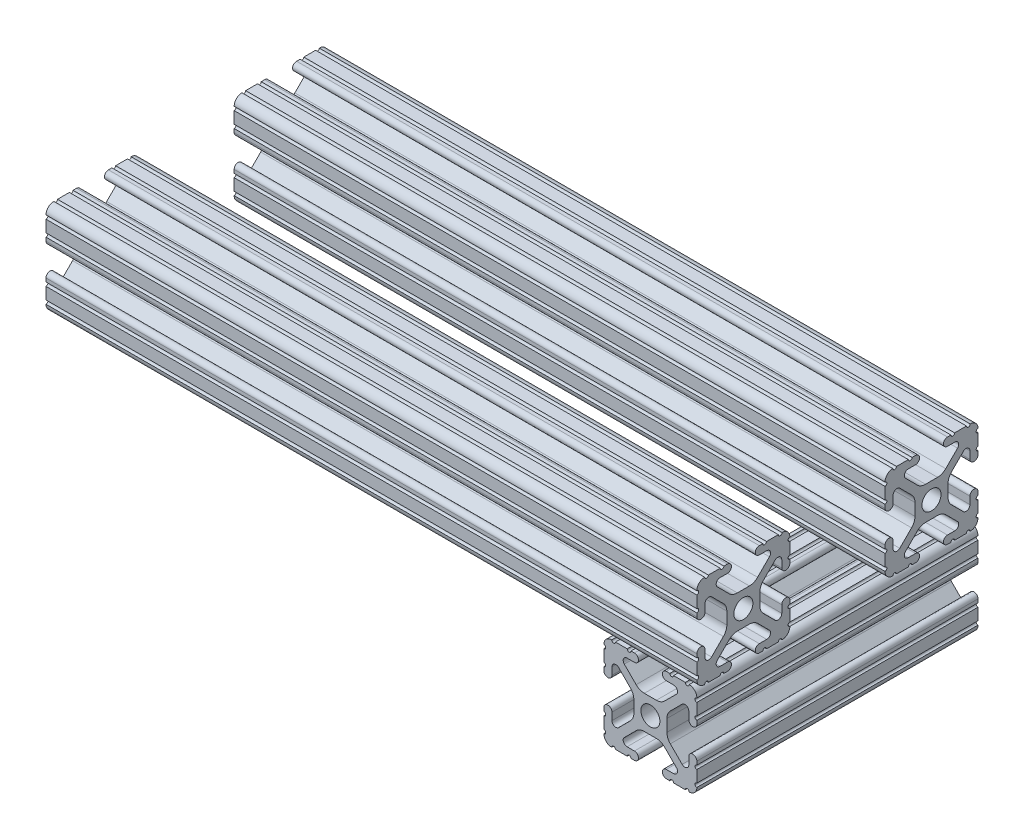
from build123d import *

# Parameters (mm, degrees)
SKETCH1_R                  = 2.6035
MEMBER_8020_1010_1_DEPTH   = 177.8
SKETCH1_ON_SEGMENT_2_R     = 2.6035
MEMBER_8020_1010_1_2_DEPTH = 177.8
SKETCH13_R                 = 2.6035
MEMBER_8020_1010_2_DEPTH   = 76.8
BODY_MOVE_COPY2_ANGLE      = 90


with BuildPart() as part:
    # Sketch1 → Member 8020 1010_1 (new body)
    with BuildSketch(Plane.XY):
        with BuildLine():
            Line((10.5918, 12.7), (10.5664, 12.7))
            ThreePointArc((10.5664, 12.7), (10.0584, 12.192), (9.5504, 12.7))
            Line((9.5504, 12.7), (6.3246, 12.7))
            ThreePointArc((6.3246, 12.7), (5.8166, 12.192), (5.3086, 12.7))
            Line((5.3086, 12.7), (4.3561, 12.7))
            ThreePointArc((4.3561, 12.7), (3.2512, 11.5951), (4.3561, 10.4902))
            Line((4.3561, 10.4902), (6.370083786, 10.4902))
            ThreePointArc((6.370083786, 10.4902), (7.348856743, 9.836204819), (7.119204175, 8.681663397))
            Line((7.119204175, 8.681663397), (3.88464389, 5.447103113))
            ThreePointArc((3.88464389, 5.447103113), (2.854599758, 4.758849627), (1.63957986, 4.517167143))
            Line((1.63957986, 4.517167143), (-1.63957986, 4.517167143))
            ThreePointArc((-1.63957986, 4.517167143), (-2.854599758, 4.758849627), (-3.88464389, 5.447103113))
            Line((-3.88464389, 5.447103113), (-7.119204175, 8.681663397))
            ThreePointArc((-7.119204175, 8.681663397), (-7.348856743, 9.836204819), (-6.370083786, 10.4902))
            Line((-6.370083786, 10.4902), (-4.3561, 10.4902))
            ThreePointArc((-4.3561, 10.4902), (-3.2512, 11.5951), (-4.3561, 12.7))
            Line((-4.3561, 12.7), (-5.3086, 12.7))
            ThreePointArc((-5.3086, 12.7), (-5.8166, 12.192), (-6.3246, 12.7))
            Line((-6.3246, 12.7), (-9.5504, 12.7))
            ThreePointArc((-9.5504, 12.7), (-10.0584, 12.192), (-10.5664, 12.7))
            Line((-10.5664, 12.7), (-10.5918, 12.7))
            ThreePointArc((-10.5918, 12.7), (-12.082522516, 12.082522516), (-12.7, 10.5918))
            Line((-12.7, 10.5918), (-12.7, 10.5664))
            ThreePointArc((-12.7, 10.5664), (-12.192, 10.0584), (-12.7, 9.5504))
            Line((-12.7, 9.5504), (-12.7, 6.3246))
            ThreePointArc((-12.7, 6.3246), (-12.192, 5.8166), (-12.7, 5.3086))
            Line((-12.7, 5.3086), (-12.7, 4.3561))
            ThreePointArc((-12.7, 4.3561), (-11.5951, 3.2512), (-10.4902, 4.3561))
            Line((-10.4902, 4.3561), (-10.4902, 6.370083786))
            ThreePointArc((-10.4902, 6.370083786), (-9.836204819, 7.348856743), (-8.681663397, 7.119204175))
            Line((-8.681663397, 7.119204175), (-5.447103113, 3.88464389))
            ThreePointArc((-5.447103113, 3.88464389), (-4.758849627, 2.854599758), (-4.517167143, 1.63957986))
            Line((-4.517167143, 1.63957986), (-4.517167143, -1.63957986))
            ThreePointArc((-4.517167143, -1.63957986), (-4.758849627, -2.854599758), (-5.447103113, -3.88464389))
            Line((-5.447103113, -3.88464389), (-8.681663397, -7.119204175))
            ThreePointArc((-8.681663397, -7.119204175), (-9.836204819, -7.348856743), (-10.4902, -6.370083786))
            Line((-10.4902, -6.370083786), (-10.4902, -4.3561))
            ThreePointArc((-10.4902, -4.3561), (-11.5951, -3.2512), (-12.7, -4.3561))
            Line((-12.7, -4.3561), (-12.7, -5.3086))
            ThreePointArc((-12.7, -5.3086), (-12.192, -5.8166), (-12.7, -6.3246))
            Line((-12.7, -6.3246), (-12.7, -9.5504))
            ThreePointArc((-12.7, -9.5504), (-12.192, -10.0584), (-12.7, -10.5664))
            Line((-12.7, -10.5664), (-12.7, -10.5918))
            ThreePointArc((-12.7, -10.5918), (-12.082522516, -12.082522516), (-10.5918, -12.7))
            Line((-10.5918, -12.7), (-10.5664, -12.7))
            ThreePointArc((-10.5664, -12.7), (-10.0584, -12.192), (-9.5504, -12.7))
            Line((-9.5504, -12.7), (-6.3246, -12.7))
            ThreePointArc((-6.3246, -12.7), (-5.8166, -12.192), (-5.3086, -12.7))
            Line((-5.3086, -12.7), (-4.3561, -12.7))
            ThreePointArc((-4.3561, -12.7), (-3.2512, -11.5951), (-4.3561, -10.4902))
            Line((-4.3561, -10.4902), (-6.370083786, -10.4902))
            ThreePointArc((-6.370083786, -10.4902), (-7.348856743, -9.836204819), (-7.119204175, -8.681663397))
            Line((-7.119204175, -8.681663397), (-3.88464389, -5.447103113))
            ThreePointArc((-3.88464389, -5.447103113), (-2.854599758, -4.758849627), (-1.63957986, -4.517167143))
            Line((-1.63957986, -4.517167143), (1.63957986, -4.517167143))
            ThreePointArc((1.63957986, -4.517167143), (2.854599758, -4.758849627), (3.88464389, -5.447103113))
            Line((3.88464389, -5.447103113), (7.119204175, -8.681663397))
            ThreePointArc((7.119204175, -8.681663397), (7.348856743, -9.836204819), (6.370083786, -10.4902))
            Line((6.370083786, -10.4902), (4.3561, -10.4902))
            ThreePointArc((4.3561, -10.4902), (3.2512, -11.5951), (4.3561, -12.7))
            Line((4.3561, -12.7), (5.3086, -12.7))
            ThreePointArc((5.3086, -12.7), (5.8166, -12.192), (6.3246, -12.7))
            Line((6.3246, -12.7), (9.5504, -12.7))
            ThreePointArc((9.5504, -12.7), (10.0584, -12.192), (10.5664, -12.7))
            Line((10.5664, -12.7), (10.5918, -12.7))
            ThreePointArc((10.5918, -12.7), (12.082522516, -12.082522516), (12.7, -10.5918))
            Line((12.7, -10.5918), (12.7, -10.5664))
            ThreePointArc((12.7, -10.5664), (12.192, -10.0584), (12.7, -9.5504))
            Line((12.7, -9.5504), (12.7, -6.3246))
            ThreePointArc((12.7, -6.3246), (12.192, -5.8166), (12.7, -5.3086))
            Line((12.7, -5.3086), (12.7, -4.3561))
            ThreePointArc((12.7, -4.3561), (11.5951, -3.2512), (10.4902, -4.3561))
            Line((10.4902, -4.3561), (10.4902, -6.370083786))
            ThreePointArc((10.4902, -6.370083786), (9.836204819, -7.348856743), (8.681663397, -7.119204175))
            Line((8.681663397, -7.119204175), (5.447103113, -3.88464389))
            ThreePointArc((5.447103113, -3.88464389), (4.758849627, -2.854599758), (4.517167143, -1.63957986))
            Line((4.517167143, -1.63957986), (4.517167143, 1.63957986))
            ThreePointArc((4.517167143, 1.63957986), (4.758849627, 2.854599758), (5.447103113, 3.88464389))
            Line((5.447103113, 3.88464389), (8.681663397, 7.119204175))
            ThreePointArc((8.681663397, 7.119204175), (9.836204819, 7.348856743), (10.4902, 6.370083786))
            Line((10.4902, 6.370083786), (10.4902, 4.3561))
            ThreePointArc((10.4902, 4.3561), (11.5951, 3.2512), (12.7, 4.3561))
            Line((12.7, 4.3561), (12.7, 5.3086))
            ThreePointArc((12.7, 5.3086), (12.192, 5.8166), (12.7, 6.3246))
            Line((12.7, 6.3246), (12.7, 9.5504))
            ThreePointArc((12.7, 9.5504), (12.192, 10.0584), (12.7, 10.5664))
            Line((12.7, 10.5664), (12.7, 10.5918))
            ThreePointArc((12.7, 10.5918), (12.082522516, 12.082522516), (10.5918, 12.7))
        make_face()
        Circle(SKETCH1_R, mode=Mode.SUBTRACT)
    extrude(amount=MEMBER_8020_1010_1_DEPTH)


with BuildPart() as body_2:
    # Sketch1 on segment 2 (carried to segment 2) → Member 8020 1010_1 2 (new body)
    with BuildSketch(Plane(origin=(51.4, 0, 0), x_dir=(1, 0, 0), z_dir=(0, 0, 1))):
        with BuildLine():
            Line((10.5918, 12.7), (10.5664, 12.7))
            ThreePointArc((10.5664, 12.7), (10.0584, 12.192), (9.5504, 12.7))
            Line((9.5504, 12.7), (6.3246, 12.7))
            ThreePointArc((6.3246, 12.7), (5.8166, 12.192), (5.3086, 12.7))
            Line((5.3086, 12.7), (4.3561, 12.7))
            ThreePointArc((4.3561, 12.7), (3.2512, 11.5951), (4.3561, 10.4902))
            Line((4.3561, 10.4902), (6.370083786, 10.4902))
            ThreePointArc((6.370083786, 10.4902), (7.348856743, 9.836204819), (7.119204175, 8.681663397))
            Line((7.119204175, 8.681663397), (3.88464389, 5.447103113))
            ThreePointArc((3.88464389, 5.447103113), (2.854599758, 4.758849627), (1.63957986, 4.517167143))
            Line((1.63957986, 4.517167143), (-1.63957986, 4.517167143))
            ThreePointArc((-1.63957986, 4.517167143), (-2.854599758, 4.758849627), (-3.88464389, 5.447103113))
            Line((-3.88464389, 5.447103113), (-7.119204175, 8.681663397))
            ThreePointArc((-7.119204175, 8.681663397), (-7.348856743, 9.836204819), (-6.370083786, 10.4902))
            Line((-6.370083786, 10.4902), (-4.3561, 10.4902))
            ThreePointArc((-4.3561, 10.4902), (-3.2512, 11.5951), (-4.3561, 12.7))
            Line((-4.3561, 12.7), (-5.3086, 12.7))
            ThreePointArc((-5.3086, 12.7), (-5.8166, 12.192), (-6.3246, 12.7))
            Line((-6.3246, 12.7), (-9.5504, 12.7))
            ThreePointArc((-9.5504, 12.7), (-10.0584, 12.192), (-10.5664, 12.7))
            Line((-10.5664, 12.7), (-10.5918, 12.7))
            ThreePointArc((-10.5918, 12.7), (-12.082522516, 12.082522516), (-12.7, 10.5918))
            Line((-12.7, 10.5918), (-12.7, 10.5664))
            ThreePointArc((-12.7, 10.5664), (-12.192, 10.0584), (-12.7, 9.5504))
            Line((-12.7, 9.5504), (-12.7, 6.3246))
            ThreePointArc((-12.7, 6.3246), (-12.192, 5.8166), (-12.7, 5.3086))
            Line((-12.7, 5.3086), (-12.7, 4.3561))
            ThreePointArc((-12.7, 4.3561), (-11.5951, 3.2512), (-10.4902, 4.3561))
            Line((-10.4902, 4.3561), (-10.4902, 6.370083786))
            ThreePointArc((-10.4902, 6.370083786), (-9.836204819, 7.348856743), (-8.681663397, 7.119204175))
            Line((-8.681663397, 7.119204175), (-5.447103113, 3.88464389))
            ThreePointArc((-5.447103113, 3.88464389), (-4.758849627, 2.854599758), (-4.517167143, 1.63957986))
            Line((-4.517167143, 1.63957986), (-4.517167143, -1.63957986))
            ThreePointArc((-4.517167143, -1.63957986), (-4.758849627, -2.854599758), (-5.447103113, -3.88464389))
            Line((-5.447103113, -3.88464389), (-8.681663397, -7.119204175))
            ThreePointArc((-8.681663397, -7.119204175), (-9.836204819, -7.348856743), (-10.4902, -6.370083786))
            Line((-10.4902, -6.370083786), (-10.4902, -4.3561))
            ThreePointArc((-10.4902, -4.3561), (-11.5951, -3.2512), (-12.7, -4.3561))
            Line((-12.7, -4.3561), (-12.7, -5.3086))
            ThreePointArc((-12.7, -5.3086), (-12.192, -5.8166), (-12.7, -6.3246))
            Line((-12.7, -6.3246), (-12.7, -9.5504))
            ThreePointArc((-12.7, -9.5504), (-12.192, -10.0584), (-12.7, -10.5664))
            Line((-12.7, -10.5664), (-12.7, -10.5918))
            ThreePointArc((-12.7, -10.5918), (-12.082522516, -12.082522516), (-10.5918, -12.7))
            Line((-10.5918, -12.7), (-10.5664, -12.7))
            ThreePointArc((-10.5664, -12.7), (-10.0584, -12.192), (-9.5504, -12.7))
            Line((-9.5504, -12.7), (-6.3246, -12.7))
            ThreePointArc((-6.3246, -12.7), (-5.8166, -12.192), (-5.3086, -12.7))
            Line((-5.3086, -12.7), (-4.3561, -12.7))
            ThreePointArc((-4.3561, -12.7), (-3.2512, -11.5951), (-4.3561, -10.4902))
            Line((-4.3561, -10.4902), (-6.370083786, -10.4902))
            ThreePointArc((-6.370083786, -10.4902), (-7.348856743, -9.836204819), (-7.119204175, -8.681663397))
            Line((-7.119204175, -8.681663397), (-3.88464389, -5.447103113))
            ThreePointArc((-3.88464389, -5.447103113), (-2.854599758, -4.758849627), (-1.63957986, -4.517167143))
            Line((-1.63957986, -4.517167143), (1.63957986, -4.517167143))
            ThreePointArc((1.63957986, -4.517167143), (2.854599758, -4.758849627), (3.88464389, -5.447103113))
            Line((3.88464389, -5.447103113), (7.119204175, -8.681663397))
            ThreePointArc((7.119204175, -8.681663397), (7.348856743, -9.836204819), (6.370083786, -10.4902))
            Line((6.370083786, -10.4902), (4.3561, -10.4902))
            ThreePointArc((4.3561, -10.4902), (3.2512, -11.5951), (4.3561, -12.7))
            Line((4.3561, -12.7), (5.3086, -12.7))
            ThreePointArc((5.3086, -12.7), (5.8166, -12.192), (6.3246, -12.7))
            Line((6.3246, -12.7), (9.5504, -12.7))
            ThreePointArc((9.5504, -12.7), (10.0584, -12.192), (10.5664, -12.7))
            Line((10.5664, -12.7), (10.5918, -12.7))
            ThreePointArc((10.5918, -12.7), (12.082522516, -12.082522516), (12.7, -10.5918))
            Line((12.7, -10.5918), (12.7, -10.5664))
            ThreePointArc((12.7, -10.5664), (12.192, -10.0584), (12.7, -9.5504))
            Line((12.7, -9.5504), (12.7, -6.3246))
            ThreePointArc((12.7, -6.3246), (12.192, -5.8166), (12.7, -5.3086))
            Line((12.7, -5.3086), (12.7, -4.3561))
            ThreePointArc((12.7, -4.3561), (11.5951, -3.2512), (10.4902, -4.3561))
            Line((10.4902, -4.3561), (10.4902, -6.370083786))
            ThreePointArc((10.4902, -6.370083786), (9.836204819, -7.348856743), (8.681663397, -7.119204175))
            Line((8.681663397, -7.119204175), (5.447103113, -3.88464389))
            ThreePointArc((5.447103113, -3.88464389), (4.758849627, -2.854599758), (4.517167143, -1.63957986))
            Line((4.517167143, -1.63957986), (4.517167143, 1.63957986))
            ThreePointArc((4.517167143, 1.63957986), (4.758849627, 2.854599758), (5.447103113, 3.88464389))
            Line((5.447103113, 3.88464389), (8.681663397, 7.119204175))
            ThreePointArc((8.681663397, 7.119204175), (9.836204819, 7.348856743), (10.4902, 6.370083786))
            Line((10.4902, 6.370083786), (10.4902, 4.3561))
            ThreePointArc((10.4902, 4.3561), (11.5951, 3.2512), (12.7, 4.3561))
            Line((12.7, 4.3561), (12.7, 5.3086))
            ThreePointArc((12.7, 5.3086), (12.192, 5.8166), (12.7, 6.3246))
            Line((12.7, 6.3246), (12.7, 9.5504))
            ThreePointArc((12.7, 9.5504), (12.192, 10.0584), (12.7, 10.5664))
            Line((12.7, 10.5664), (12.7, 10.5918))
            ThreePointArc((12.7, 10.5918), (12.082522516, 12.082522516), (10.5918, 12.7))
        make_face()
        Circle(SKETCH1_ON_SEGMENT_2_R, mode=Mode.SUBTRACT)
    extrude(amount=MEMBER_8020_1010_1_2_DEPTH)


with BuildPart() as body_3:
    # Sketch13 → Member 8020 1010_2 (new body)
    with BuildSketch(Plane(origin=(64.1, -25.4, 12.7), x_dir=(0, 1, 0), z_dir=(-1, 0, 0))):
        with BuildLine():
            Line((10.5918, 12.7), (10.5664, 12.7))
            ThreePointArc((10.5664, 12.7), (10.0584, 12.192), (9.5504, 12.7))
            Line((9.5504, 12.7), (6.3246, 12.7))
            ThreePointArc((6.3246, 12.7), (5.8166, 12.192), (5.3086, 12.7))
            Line((5.3086, 12.7), (4.3561, 12.7))
            ThreePointArc((4.3561, 12.7), (3.2512, 11.5951), (4.3561, 10.4902))
            Line((4.3561, 10.4902), (6.370083786, 10.4902))
            ThreePointArc((6.370083786, 10.4902), (7.348856743, 9.836204819), (7.119204175, 8.681663397))
            Line((7.119204175, 8.681663397), (3.88464389, 5.447103113))
            ThreePointArc((3.88464389, 5.447103113), (2.854599758, 4.758849627), (1.63957986, 4.517167143))
            Line((1.63957986, 4.517167143), (-1.63957986, 4.517167143))
            ThreePointArc((-1.63957986, 4.517167143), (-2.854599758, 4.758849627), (-3.88464389, 5.447103113))
            Line((-3.88464389, 5.447103113), (-7.119204175, 8.681663397))
            ThreePointArc((-7.119204175, 8.681663397), (-7.348856743, 9.836204819), (-6.370083786, 10.4902))
            Line((-6.370083786, 10.4902), (-4.3561, 10.4902))
            ThreePointArc((-4.3561, 10.4902), (-3.2512, 11.5951), (-4.3561, 12.7))
            Line((-4.3561, 12.7), (-5.3086, 12.7))
            ThreePointArc((-5.3086, 12.7), (-5.8166, 12.192), (-6.3246, 12.7))
            Line((-6.3246, 12.7), (-9.5504, 12.7))
            ThreePointArc((-9.5504, 12.7), (-10.0584, 12.192), (-10.5664, 12.7))
            Line((-10.5664, 12.7), (-10.5918, 12.7))
            ThreePointArc((-10.5918, 12.7), (-12.082522516, 12.082522516), (-12.7, 10.5918))
            Line((-12.7, 10.5918), (-12.7, 10.5664))
            ThreePointArc((-12.7, 10.5664), (-12.192, 10.0584), (-12.7, 9.5504))
            Line((-12.7, 9.5504), (-12.7, 6.3246))
            ThreePointArc((-12.7, 6.3246), (-12.192, 5.8166), (-12.7, 5.3086))
            Line((-12.7, 5.3086), (-12.7, 4.3561))
            ThreePointArc((-12.7, 4.3561), (-11.5951, 3.2512), (-10.4902, 4.3561))
            Line((-10.4902, 4.3561), (-10.4902, 6.370083786))
            ThreePointArc((-10.4902, 6.370083786), (-9.836204819, 7.348856743), (-8.681663397, 7.119204175))
            Line((-8.681663397, 7.119204175), (-5.447103113, 3.88464389))
            ThreePointArc((-5.447103113, 3.88464389), (-4.758849627, 2.854599758), (-4.517167143, 1.63957986))
            Line((-4.517167143, 1.63957986), (-4.517167143, -1.63957986))
            ThreePointArc((-4.517167143, -1.63957986), (-4.758849627, -2.854599758), (-5.447103113, -3.88464389))
            Line((-5.447103113, -3.88464389), (-8.681663397, -7.119204175))
            ThreePointArc((-8.681663397, -7.119204175), (-9.836204819, -7.348856743), (-10.4902, -6.370083786))
            Line((-10.4902, -6.370083786), (-10.4902, -4.3561))
            ThreePointArc((-10.4902, -4.3561), (-11.5951, -3.2512), (-12.7, -4.3561))
            Line((-12.7, -4.3561), (-12.7, -5.3086))
            ThreePointArc((-12.7, -5.3086), (-12.192, -5.8166), (-12.7, -6.3246))
            Line((-12.7, -6.3246), (-12.7, -9.5504))
            ThreePointArc((-12.7, -9.5504), (-12.192, -10.0584), (-12.7, -10.5664))
            Line((-12.7, -10.5664), (-12.7, -10.5918))
            ThreePointArc((-12.7, -10.5918), (-12.082522516, -12.082522516), (-10.5918, -12.7))
            Line((-10.5918, -12.7), (-10.5664, -12.7))
            ThreePointArc((-10.5664, -12.7), (-10.0584, -12.192), (-9.5504, -12.7))
            Line((-9.5504, -12.7), (-6.3246, -12.7))
            ThreePointArc((-6.3246, -12.7), (-5.8166, -12.192), (-5.3086, -12.7))
            Line((-5.3086, -12.7), (-4.3561, -12.7))
            ThreePointArc((-4.3561, -12.7), (-3.2512, -11.5951), (-4.3561, -10.4902))
            Line((-4.3561, -10.4902), (-6.370083786, -10.4902))
            ThreePointArc((-6.370083786, -10.4902), (-7.348856743, -9.836204819), (-7.119204175, -8.681663397))
            Line((-7.119204175, -8.681663397), (-3.88464389, -5.447103113))
            ThreePointArc((-3.88464389, -5.447103113), (-2.854599758, -4.758849627), (-1.63957986, -4.517167143))
            Line((-1.63957986, -4.517167143), (1.63957986, -4.517167143))
            ThreePointArc((1.63957986, -4.517167143), (2.854599758, -4.758849627), (3.88464389, -5.447103113))
            Line((3.88464389, -5.447103113), (7.119204175, -8.681663397))
            ThreePointArc((7.119204175, -8.681663397), (7.348856743, -9.836204819), (6.370083786, -10.4902))
            Line((6.370083786, -10.4902), (4.3561, -10.4902))
            ThreePointArc((4.3561, -10.4902), (3.2512, -11.5951), (4.3561, -12.7))
            Line((4.3561, -12.7), (5.3086, -12.7))
            ThreePointArc((5.3086, -12.7), (5.8166, -12.192), (6.3246, -12.7))
            Line((6.3246, -12.7), (9.5504, -12.7))
            ThreePointArc((9.5504, -12.7), (10.0584, -12.192), (10.5664, -12.7))
            Line((10.5664, -12.7), (10.5918, -12.7))
            ThreePointArc((10.5918, -12.7), (12.082522516, -12.082522516), (12.7, -10.5918))
            Line((12.7, -10.5918), (12.7, -10.5664))
            ThreePointArc((12.7, -10.5664), (12.192, -10.0584), (12.7, -9.5504))
            Line((12.7, -9.5504), (12.7, -6.3246))
            ThreePointArc((12.7, -6.3246), (12.192, -5.8166), (12.7, -5.3086))
            Line((12.7, -5.3086), (12.7, -4.3561))
            ThreePointArc((12.7, -4.3561), (11.5951, -3.2512), (10.4902, -4.3561))
            Line((10.4902, -4.3561), (10.4902, -6.370083786))
            ThreePointArc((10.4902, -6.370083786), (9.836204819, -7.348856743), (8.681663397, -7.119204175))
            Line((8.681663397, -7.119204175), (5.447103113, -3.88464389))
            ThreePointArc((5.447103113, -3.88464389), (4.758849627, -2.854599758), (4.517167143, -1.63957986))
            Line((4.517167143, -1.63957986), (4.517167143, 1.63957986))
            ThreePointArc((4.517167143, 1.63957986), (4.758849627, 2.854599758), (5.447103113, 3.88464389))
            Line((5.447103113, 3.88464389), (8.681663397, 7.119204175))
            ThreePointArc((8.681663397, 7.119204175), (9.836204819, 7.348856743), (10.4902, 6.370083786))
            Line((10.4902, 6.370083786), (10.4902, 4.3561))
            ThreePointArc((10.4902, 4.3561), (11.5951, 3.2512), (12.7, 4.3561))
            Line((12.7, 4.3561), (12.7, 5.3086))
            ThreePointArc((12.7, 5.3086), (12.192, 5.8166), (12.7, 6.3246))
            Line((12.7, 6.3246), (12.7, 9.5504))
            ThreePointArc((12.7, 9.5504), (12.192, 10.0584), (12.7, 10.5664))
            Line((12.7, 10.5664), (12.7, 10.5918))
            ThreePointArc((12.7, 10.5918), (12.082522516, 12.082522516), (10.5918, 12.7))
        make_face()
        Circle(SKETCH13_R, mode=Mode.SUBTRACT)
    extrude(amount=MEMBER_8020_1010_2_DEPTH)


with BuildPart() as body_2_1:
    # Body-Move/Copy2: moved
    add(body_2.part.rotate(Axis((23.29609375, 0, 82.55), (0, -1, 0)), BODY_MOVE_COPY2_ANGLE))


with BuildPart() as part_1:
    # Body-Move/Copy2: moved
    add(part.part.rotate(Axis((23.29609375, 0, 82.55), (0, -1, 0)), BODY_MOVE_COPY2_ANGLE))


with BuildPart() as body_3_1:
    # Body-Move/Copy2: moved
    add(body_3.part.rotate(Axis((23.29609375, 0, 82.55), (0, -1, 0)), BODY_MOVE_COPY2_ANGLE))


solid = Compound([body_2_1.part, part_1.part, body_3_1.part])
